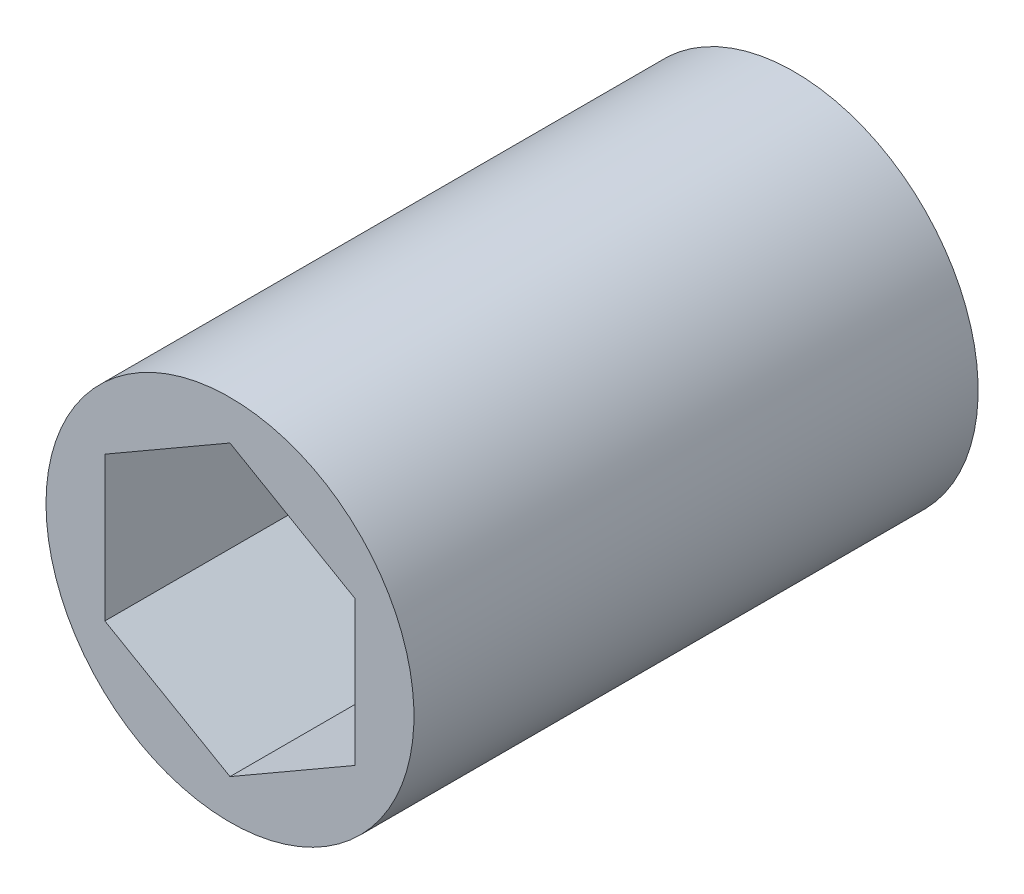
from build123d import *

# Parameters (mm, degrees)
SKETCH1_R           = 9.525
BOSS_EXTRUDE1_DEPTH = 14.605


with BuildPart() as part:
    # Sketch1 → Boss-Extrude1 (new, symmetric)
    with BuildSketch(Plane.XY):
        with Locations(Location((0, 0, 0), (0, 0, 180))):
            Circle(SKETCH1_R)
        Polygon((0, 7.478995387), (-6.477, 3.739497694), (-6.477, -3.739497694), (0, -7.478995387), (6.477, -3.739497694), (6.477, 3.739497694), align=None, mode=Mode.SUBTRACT)
    extrude(amount=BOSS_EXTRUDE1_DEPTH, both=True)


solid = part.part
